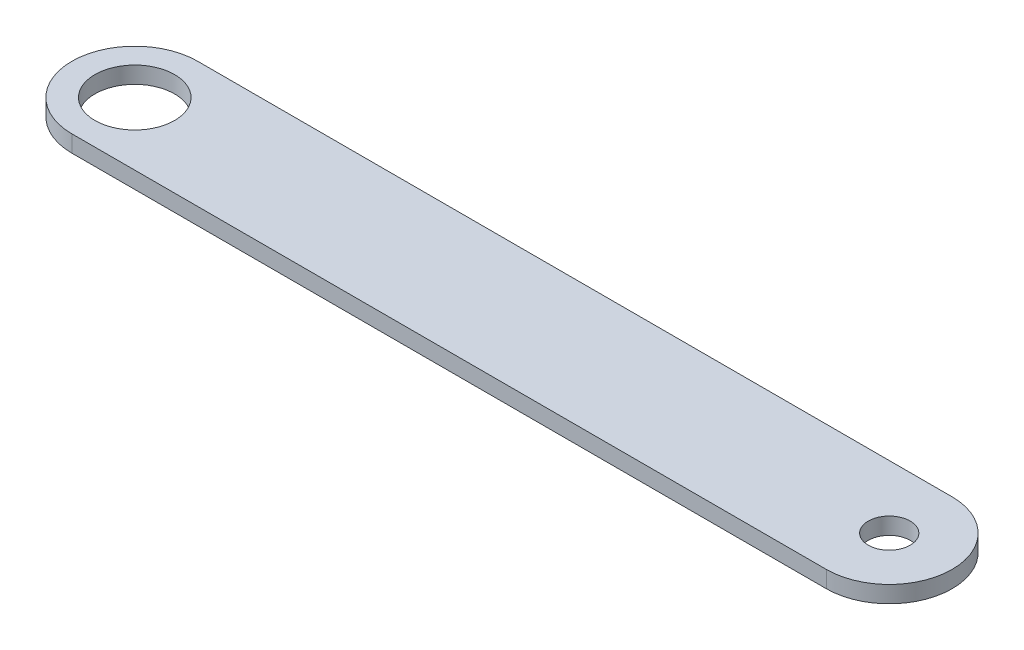
from build123d import *

# Parameters (mm, degrees)
EXTRUDE_1_DEPTH     = 4
SKETCH_2_R          = 5
SKETCH_2_R_2        = 9.5
CUT_EXTRUDE_1_DEPTH = 196.616972679


with BuildPart() as part:
    # 草图1 → 凸台-拉伸1 (new body)
    with BuildSketch(Plane(origin=(0, 0, 0), x_dir=(1, 0, 0), z_dir=(0, 1, 0))):
        with BuildLine():
            Line((0, -15), (-180, -15))
            ThreePointArc((-180, -15), (-195, 0), (-180, 15))
            Line((-180, 15), (0, 15))
            ThreePointArc((0, 15), (15, 0), (0, -15))
        make_face()
    extrude(amount=EXTRUDE_1_DEPTH)

    # 草图2 → 切除-拉伸1 (cut, through all)
    with BuildSketch(Plane(origin=(0, 4, 0), x_dir=(1, 0, 0), z_dir=(0, 1, 0))):
        with Locations(Location((0, 0, 0), (0, 0, 270))):
            Circle(SKETCH_2_R)
        with Locations(Location((-180, 0, 0), (0, 0, 270))):
            Circle(SKETCH_2_R_2)
    extrude(amount=-CUT_EXTRUDE_1_DEPTH, mode=Mode.SUBTRACT)


solid = part.part
